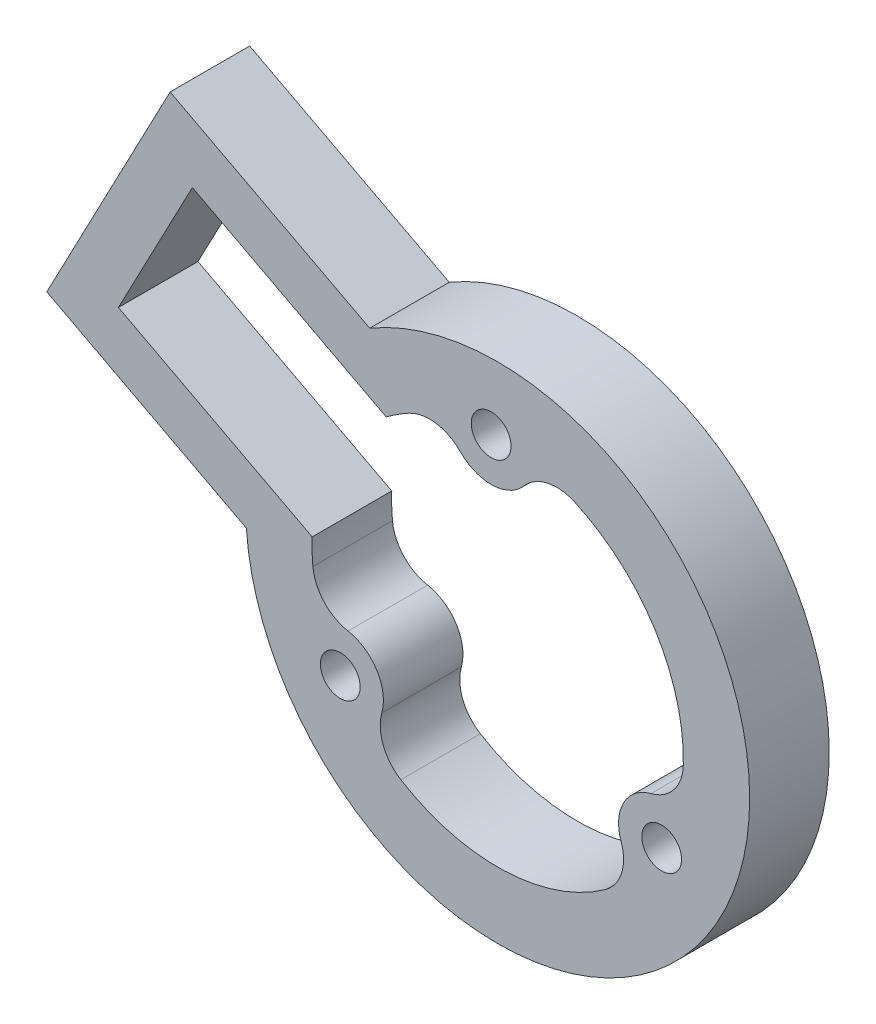
from build123d import *

# Parameters (mm, degrees)
ESQUISSE1_R        = 1.5
BOSS_EXTRU_2_DEPTH = 6


with BuildPart() as part:
    # Esquisse1 → Boss.-Extru.2 (new body)
    with BuildSketch(Plane.XY):
        with BuildLine():
            Line((-9.65239237, 16.365552894), (-24.702558299, 24.270773037))
            Line((-24.702558299, 24.270773037), (-34.00281729, 6.564695473))
            Line((-34.00281729, 6.564695473), (-18.952651361, -1.34052467))
            ThreePointArc((-18.952651361, -1.34052467), (16.820773686, -8.835246042), (-9.65239237, 16.365552894))
        make_face()
        with Locations((-0.493805045, 13.991288596)):
            Circle(ESQUISSE1_R, mode=Mode.SUBTRACT)
        with Locations((12.363713879, -6.567996584)):
            Circle(ESQUISSE1_R, mode=Mode.SUBTRACT)
        with Locations((-11.869908833, -7.423292012)):
            Circle(ESQUISSE1_R, mode=Mode.SUBTRACT)
        with BuildLine():
            Line((-11.512444168, 12.824337382), (-23.021394585, 18.869505726))
            Line((-23.021394585, 18.869505726), (-28.601549979, 8.245859187))
            Line((-28.601549979, 8.245859187), (-17.092599563, 2.200690843))
            Line((-17.092599563, 2.200690843), (-13.988384403, 0.570176979))
            ThreePointArc((-13.988384403, 0.570176979), (-13.994675648, -0.386074479), (-13.935673418, -1.34052467))
            ThreePointArc((-13.935673418, -1.34052467), (-13.094244538, -3.227739126), (-11.285257604, -4.226311727))
            ThreePointArc((-11.285257604, -4.226311727), (-9.114394283, -5.700027795), (-8.739535981, -8.296942861))
            ThreePointArc((-8.739535981, -8.296942861), (-8.633495068, -10.360516531), (-7.304956633, -11.943098785))
            ThreePointArc((-7.304956633, -11.943098785), (0.493805045, -13.991288596), (8.128765127, -11.398384864))
            ThreePointArc((8.128765127, -11.398384864), (9.342426349, -9.72607885), (9.302722122, -7.66016391))
            ThreePointArc((9.302722122, -7.66016391), (9.493566014, -5.043283091), (11.555131282, -3.420188746))
            ThreePointArc((11.555131282, -3.420188746), (13.289218046, -2.296567787), (13.995505264, -0.354728625))
            ThreePointArc((13.995505264, -0.354728625), (11.869908833, 7.423292012), (5.806908291, 12.738909534))
            ThreePointArc((5.806908291, 12.738909534), (3.751818189, 12.953817976), (1.982535482, 11.886475637))
            ThreePointArc((1.982535482, 11.886475637), (-0.379171731, 10.743310886), (-2.815595301, 11.717131607))
            ThreePointArc((-2.815595301, 11.717131607), (-4.655722978, 12.657084318), (-6.690548632, 12.29782741))
            ThreePointArc((-6.690548632, 12.29782741), (-7.569542767, 11.777182273), (-8.408229009, 11.193823517))
            Line((-8.408229009, 11.193823517), (-11.512444168, 12.824337382))
        make_face(mode=Mode.SUBTRACT)
    extrude(amount=BOSS_EXTRU_2_DEPTH)


solid = part.part
